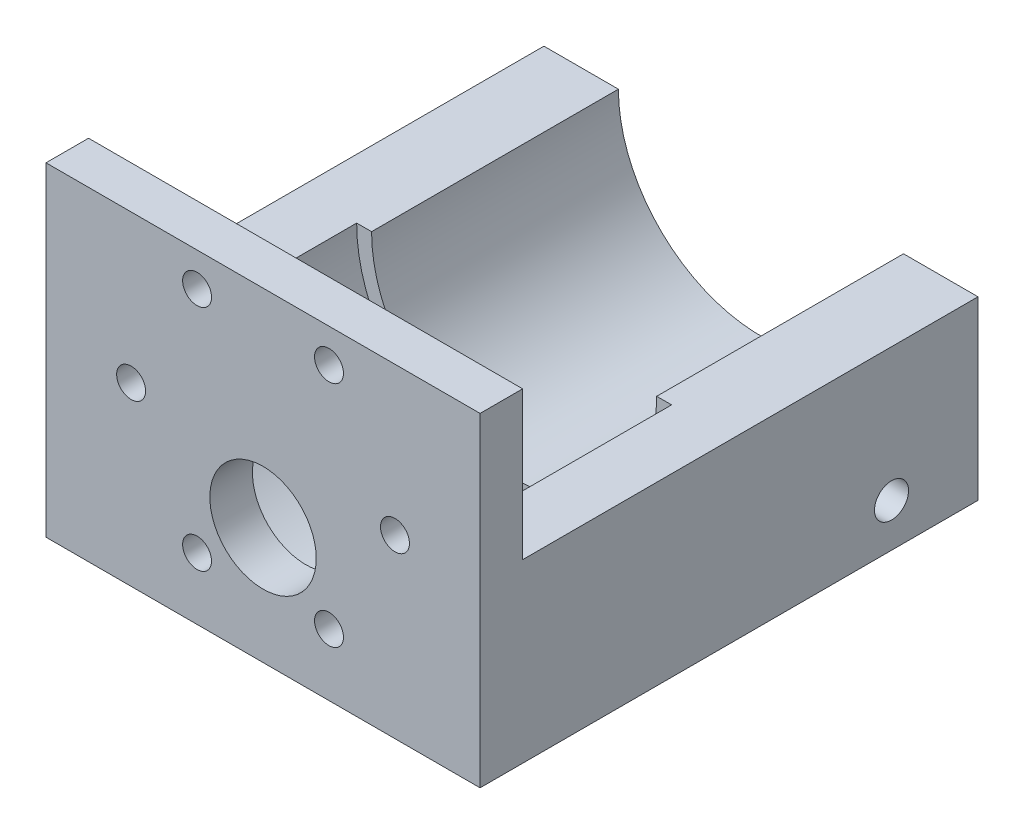
from build123d import *

# Parameters (mm, degrees)
BOSS_EXTRUDE1_DEPTH = 24.500000006
SKETCH2_W           = 51
SKETCH2_H           = 38.1
SKETCH2_R           = 6.25
SKETCH2_R_2         = 1.7
BOSS_EXTRUDE2_DEPTH = 5
BOSS_EXTRUDE3_DEPTH = 29
SKETCH4_R           = 2.000000064
CUT_EXTRUDE1_DEPTH  = 6.99999997
SKETCH5_R           = 2.000000064
CUT_EXTRUDE2_DEPTH  = 6.99999997
CUT_EXTRUDE3_START  = -6.99999997
SKETCH6_R           = 2.000000064
CUT_EXTRUDE3_DEPTH  = 6.99999997


with BuildPart() as part:
    # Sketch1 → Boss-Extrude1 (new body)
    with BuildSketch(Plane.XY):
        with BuildLine():
            Line((18.5, 0), (25.5, 0))
            Line((25.5, 0), (25.5, -20.716))
            Line((25.5, -20.716), (-25.5, -20.716))
            Line((-25.5, -20.716), (-25.5, 0))
            Line((-25.5, 0), (-18.5, 0))
            ThreePointArc((-18.5, 0), (0, -18.5), (18.5, 0))
        make_face()
    extrude(amount=BOSS_EXTRUDE1_DEPTH)

    # Sketch2 → Boss-Extrude2 (add)
    with BuildSketch(Plane.XY.offset(24.500000006)):
        with Locations((0, -1.666)):
            Rectangle(SKETCH2_W, SKETCH2_H)
        with Locations((0, -7)):
            Circle(SKETCH2_R, mode=Mode.SUBTRACT)
        with Locations((15.5, 0)):
            Circle(SKETCH2_R_2, mode=Mode.SUBTRACT)
        with Locations((-7.75, -13.423393759)):
            Circle(SKETCH2_R_2, mode=Mode.SUBTRACT)
        with Locations((-7.75, 13.423393759)):
            Circle(SKETCH2_R_2, mode=Mode.SUBTRACT)
        with Locations((-15.5, 0)):
            Circle(SKETCH2_R_2, mode=Mode.SUBTRACT)
        with Locations((7.75, 13.423393759)):
            Circle(SKETCH2_R_2, mode=Mode.SUBTRACT)
        with Locations((7.75, -13.423393759)):
            Circle(SKETCH2_R_2, mode=Mode.SUBTRACT)
    extrude(amount=BOSS_EXTRUDE2_DEPTH)

    # Sketch3 → Boss-Extrude3 (add)
    with BuildSketch(Plane(origin=(0, 0, 0), x_dir=(-1, 0, 0), z_dir=(0, 0, -1))):
        with BuildLine():
            Line((16.75, 0), (25.5, 0))
            Line((25.5, 0), (25.5, -20.716))
            Line((25.5, -20.716), (-25.5, -20.716))
            Line((-25.5, -20.716), (-25.5, 0))
            Line((-25.5, 0), (-16.75, 0))
            ThreePointArc((-16.75, 0), (0, -16.75), (16.75, 0))
        make_face()
    extrude(amount=BOSS_EXTRUDE3_DEPTH)

    # Sketch4 → Cut-Extrude1 (cut)
    with BuildSketch(Plane.XZ.offset(20.716)):
        with Locations((-21.69, 25.690000006)):
            Circle(SKETCH4_R)
        with Locations((21.69, 25.690000006)):
            Circle(SKETCH4_R)
        with Locations((-21.69, -25.19)):
            Circle(SKETCH4_R)
        with Locations((21.69, -25.19)):
            Circle(SKETCH4_R)
    extrude(amount=-CUT_EXTRUDE1_DEPTH, mode=Mode.SUBTRACT)

    # Sketch5 → Cut-Extrude2 (cut)
    with BuildSketch(Plane.ZY.offset(25.5)):
        with Locations((-18.84, -15.636)):
            Circle(SKETCH5_R)
    extrude(amount=-CUT_EXTRUDE2_DEPTH, mode=Mode.SUBTRACT)

    # Sketch6 → Cut-Extrude3 (cut)
    with BuildSketch(Plane(origin=(25.5, 0, 0), x_dir=(0, 0, -1), z_dir=(1, 0, 0)).offset(CUT_EXTRUDE3_START)):
        with Locations(Location((18.84, -15.636, 0), (0, 0, 180))):
            Circle(SKETCH6_R)
    extrude(amount=CUT_EXTRUDE3_DEPTH, mode=Mode.SUBTRACT)


solid = part.part
